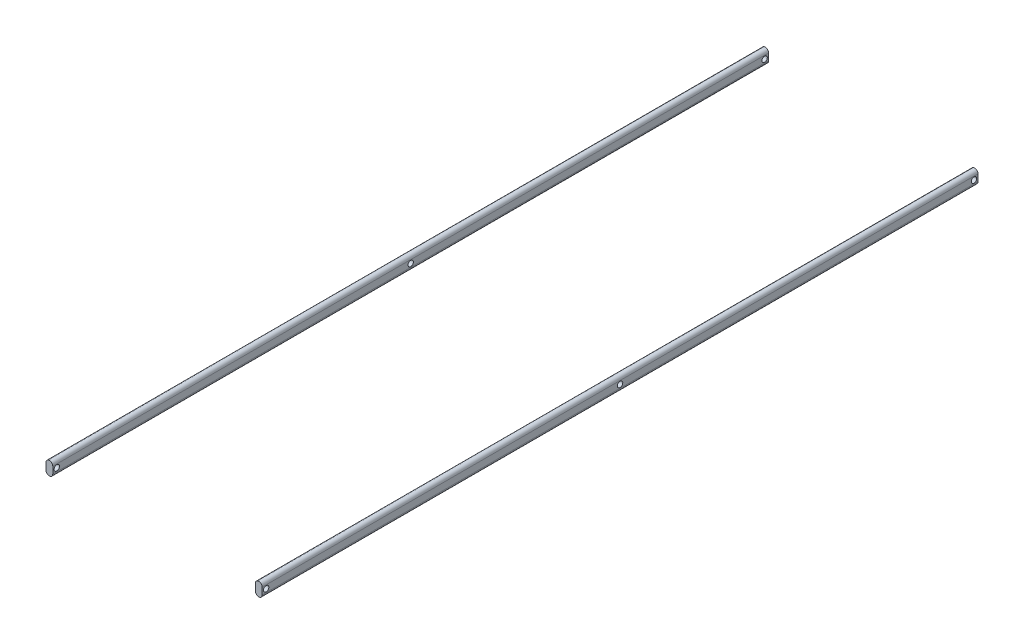
from build123d import *

# Parameters (mm, degrees)
BOSS_EXTRUDE1_DEPTH   = 530
F_4_0MM_DOWEL_HOLE1_D = 4
SKETCH5_W             = 150
SKETCH5_H             = 85.013132282
CUT_EXTRUDE1_DEPTH    = 10
SKETCH6_W             = 150
SKETCH6_H             = 150
CUT_EXTRUDE2_DEPTH    = 546.892643088
SKETCH7_W             = 150
SKETCH7_H             = 27.986867718
BOSS_EXTRUDE2_DEPTH   = 2
SKETCH8_W             = 150
SKETCH8_H             = 388.643784195
CUT_EXTRUDE3_DEPTH    = 546.961333592
FILLET1_RADIUS        = 2.5
FILLET1_LENGTH        = 530
FILLET2_RADIUS        = 2.5
FILLET2_LENGTH        = 530
FILLET3_RADIUS        = 2.5
FILLET3_LENGTH        = 530
FILLET4_RADIUS        = 2.5
FILLET4_LENGTH        = 530


with BuildPart() as part:
    # Sketch1 → Boss-Extrude1 (new body)
    with BuildSketch(Plane.XY):
        Polygon((-130.666666667, 2.75), (-130.666666667, -7.25), (29.333333333, -7.25), (29.333333333, 2.75), (24.333333333, 2.75), (24.333333333, -2.25), (-125.666666667, -2.25), (-125.666666667, 2.75), align=None)
    extrude(amount=BOSS_EXTRUDE1_DEPTH)

    # Ø4.0mm Dowel Hole1 (through all)
    with Locations(Plane(origin=(29.333333333, 0, 0), x_dir=(0, 0, -1), z_dir=(1, 0, 0))):
        with Locations((-527, -2.25), (-265, -2.25), (-3, -2.25)):
            Hole(F_4_0MM_DOWEL_HOLE1_D / 2)

    # Sketch5 → Cut-Extrude1 (cut)
    with BuildSketch(Plane(origin=(0, -2.25, 0), x_dir=(1, 0, 0), z_dir=(0, 1, 0))):
        with Locations((-50.666666667, -42.506566141)):
            Rectangle(SKETCH5_W, SKETCH5_H)
    extrude(amount=-CUT_EXTRUDE1_DEPTH, mode=Mode.SUBTRACT)

    # Sketch6 → Cut-Extrude2 (cut, through all)
    with BuildSketch(Plane(origin=(0, -2.25, 0), x_dir=(1, 0, 0), z_dir=(0, 1, 0))):
        with Locations((-50.666666667, -160.013132282)):
            Rectangle(SKETCH6_W, SKETCH6_H)
    extrude(amount=-CUT_EXTRUDE2_DEPTH, mode=Mode.SUBTRACT)

    # Sketch7 → Boss-Extrude2 (add)
    with BuildSketch(Plane(origin=(0, 2.75, 0), x_dir=(1, 0, 0), z_dir=(0, 1, 0))):
        with Locations((-50.666666667, -249.006566141)):
            Rectangle(SKETCH7_W, SKETCH7_H)
    extrude(amount=-BOSS_EXTRUDE2_DEPTH)

    # Sketch8 → Cut-Extrude3 (cut, through all)
    with BuildSketch(Plane.XZ.offset(7.25)):
        with Locations((-50.666666667, 429.33502438)):
            Rectangle(SKETCH8_W, SKETCH8_H)
    extrude(amount=-CUT_EXTRUDE3_DEPTH, mode=Mode.SUBTRACT)


with BuildPart() as cut_extrude3_piece_1:
    # of the separate pieces the step leaves, piece 1, a body of its own (cut_extrude3_pieces)
    add(part.part.solids().sort_by_distance((29.333333333, 2.75, 530))[0])

    # Fillet1: full round fillet: the end face becomes a half cylinder, R = half its width
    fillet1_face = Plane((26.833333333, -7.25, 265), x_dir=(0, 0, 1), z_dir=(0, -1, 0))  # on the end face: x along it, z out of the body
    fillet1_slab = fillet1_face.offset(-FILLET1_RADIUS / 2) * Box(FILLET1_LENGTH, 2 * FILLET1_RADIUS, FILLET1_RADIUS, mode=Mode.PRIVATE)  # the body's end, R deep
    fillet1_round = Plane((26.833333333, -4.75, 265), x_dir=(0, -1, 0), z_dir=(0, 0, 1)) * Cylinder(FILLET1_RADIUS, FILLET1_LENGTH, mode=Mode.PRIVATE)  # its axis R under the face
    add(fillet1_slab - fillet1_round, mode=Mode.SUBTRACT)

    # Fillet2: full round fillet: the end face becomes a half cylinder, R = half its width
    fillet2_face = Plane((26.833333333, 2.75, 265), x_dir=(0, 0, 1), z_dir=(0, 1, 0))  # on the end face: x along it, z out of the body
    fillet2_slab = fillet2_face.offset(-FILLET2_RADIUS / 2) * Box(FILLET2_LENGTH, 2 * FILLET2_RADIUS, FILLET2_RADIUS, mode=Mode.PRIVATE)  # the body's end, R deep
    fillet2_round = Plane((26.833333333, 0.25, 265), x_dir=(0, 1, 0), z_dir=(0, 0, 1)) * Cylinder(FILLET2_RADIUS, FILLET2_LENGTH, mode=Mode.PRIVATE)  # its axis R under the face
    add(fillet2_slab - fillet2_round, mode=Mode.SUBTRACT)


with BuildPart() as cut_extrude3_piece_2:
    # of the separate pieces the step leaves, piece 2, a body of its own (cut_extrude3_pieces)
    add(part.part.solids().sort_by_distance((-130.666666667, 2.75, 0))[0])

    # Fillet3: full round fillet: the end face becomes a half cylinder, R = half its width
    fillet3_face = Plane((-128.166666667, -7.25, 265), x_dir=(0, 0, -1), z_dir=(0, -1, 0))  # on the end face: x along it, z out of the body
    fillet3_slab = fillet3_face.offset(-FILLET3_RADIUS / 2) * Box(FILLET3_LENGTH, 2 * FILLET3_RADIUS, FILLET3_RADIUS, mode=Mode.PRIVATE)  # the body's end, R deep
    fillet3_round = Plane((-128.166666667, -4.75, 265), x_dir=(0, -1, 0), z_dir=(0, 0, -1)) * Cylinder(FILLET3_RADIUS, FILLET3_LENGTH, mode=Mode.PRIVATE)  # its axis R under the face
    add(fillet3_slab - fillet3_round, mode=Mode.SUBTRACT)

    # Fillet4: full round fillet: the end face becomes a half cylinder, R = half its width
    fillet4_face = Plane((-128.166666667, 2.75, 265), x_dir=(0, 0, -1), z_dir=(0, 1, 0))  # on the end face: x along it, z out of the body
    fillet4_slab = fillet4_face.offset(-FILLET4_RADIUS / 2) * Box(FILLET4_LENGTH, 2 * FILLET4_RADIUS, FILLET4_RADIUS, mode=Mode.PRIVATE)  # the body's end, R deep
    fillet4_round = Plane((-128.166666667, 0.25, 265), x_dir=(0, 1, 0), z_dir=(0, 0, -1)) * Cylinder(FILLET4_RADIUS, FILLET4_LENGTH, mode=Mode.PRIVATE)  # its axis R under the face
    add(fillet4_slab - fillet4_round, mode=Mode.SUBTRACT)


solid = Compound([cut_extrude3_piece_1.part, cut_extrude3_piece_2.part])
